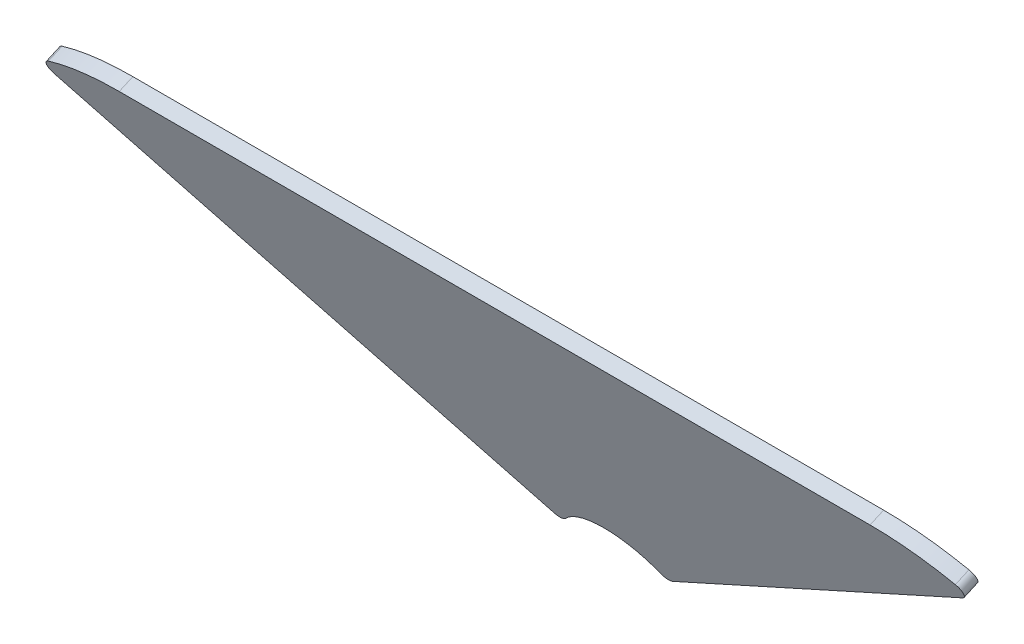
from build123d import *

# Parameters (mm, degrees)
BOSS_EXTRUDE1_DEPTH = 6.35
FILLET1_R           = 3.81


with BuildPart() as part:
    # Sketch3 → Boss-Extrude1 (new body)
    with BuildSketch(Plane(origin=(837.176459039, 964.119586349, 1717.192521197), x_dir=(-1, 0, 0), z_dir=(0, 0.4075747752498649, -0.913171836282757))):
        with BuildLine():
            Line((137.874265639, -126.392405854), (-26.505638525, -18.937567822))
            Line((-26.505638525, -18.937567822), (-39.07644953, -10.720052017))
            ThreePointArc((-39.07644953, -10.720052017), (-20.260111199, -2.728624711), (0, 0))
            Line((0, 0), (320.198396744, 0))
            ThreePointArc((320.198396744, 0), (340.458416927, -2.728663039), (359.274618149, -10.720195518))
            Line((359.274618149, -10.720195518), (346.703910708, -18.937649247))
            Line((346.703910708, -18.937649247), (182.324265639, -126.392391447))
            ThreePointArc((182.324265639, -126.392391447), (160.099261742, -114.368537545), (137.874265639, -126.392405854))
        make_face()
    extrude(amount=BOSS_EXTRUDE1_DEPTH)

    # Fillet1
    fillet1_edges = [part.edges().sort_by_distance(p)[0] for p in [
        (699.3021934, 849.995650915, 1662.778844207),
        (876.252908569, 955.624386675, 1709.923977825),
        (477.90184089, 955.624255635, 1709.923919338),
        (654.8521934, 849.995664071, 1662.778850079),
    ]]
    fillet(fillet1_edges, radius=FILLET1_R)


solid = part.part
